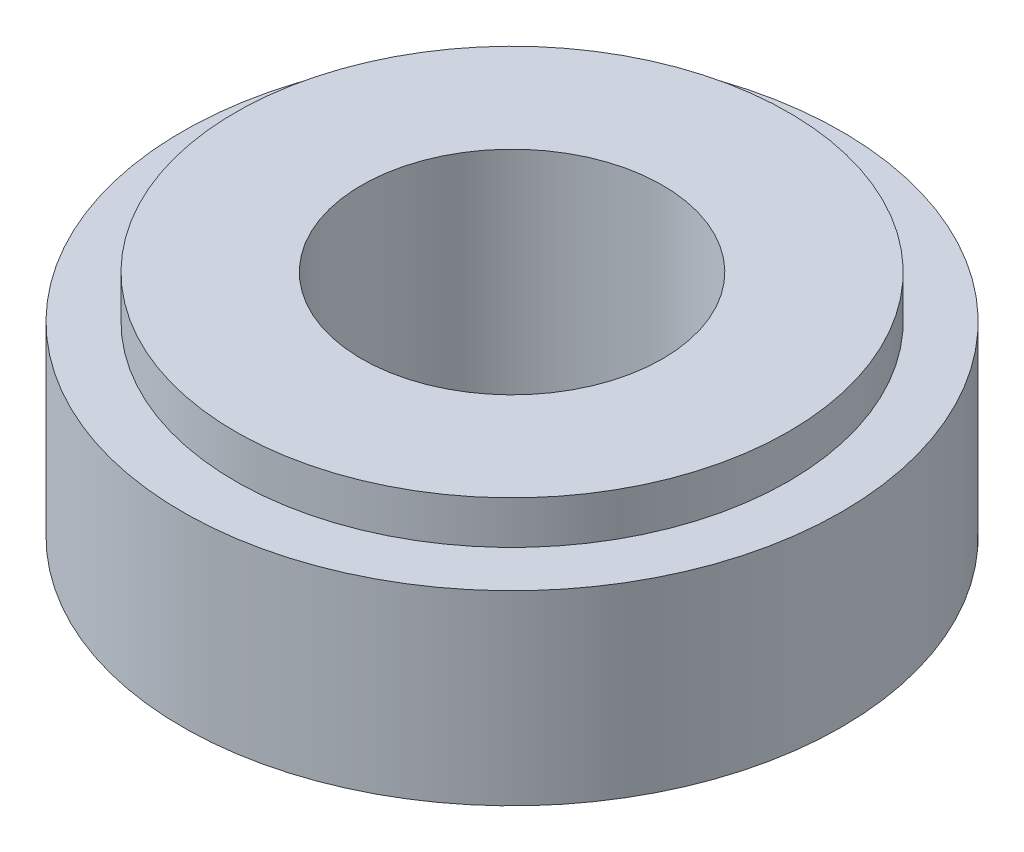
from build123d import *


with BuildPart() as part:
    # Sketch1 → Revolve1 (revolve)
    with BuildSketch(Plane.XY, mode=Mode.PRIVATE) as revolve1_sk:
        Polygon((-2.625, 0), (-5.75, 0), (-5.75, 3.25), (-4.825, 3.25), (-4.825, 4), (-2.625, 4), align=None)
    revolve(revolve1_sk.sketch.rotate(Axis((0, -126.622860864, 0), (0, 1, 0)), 180), axis=Axis((0, -126.622860864, 0), (0, 1, 0)))


solid = part.part
